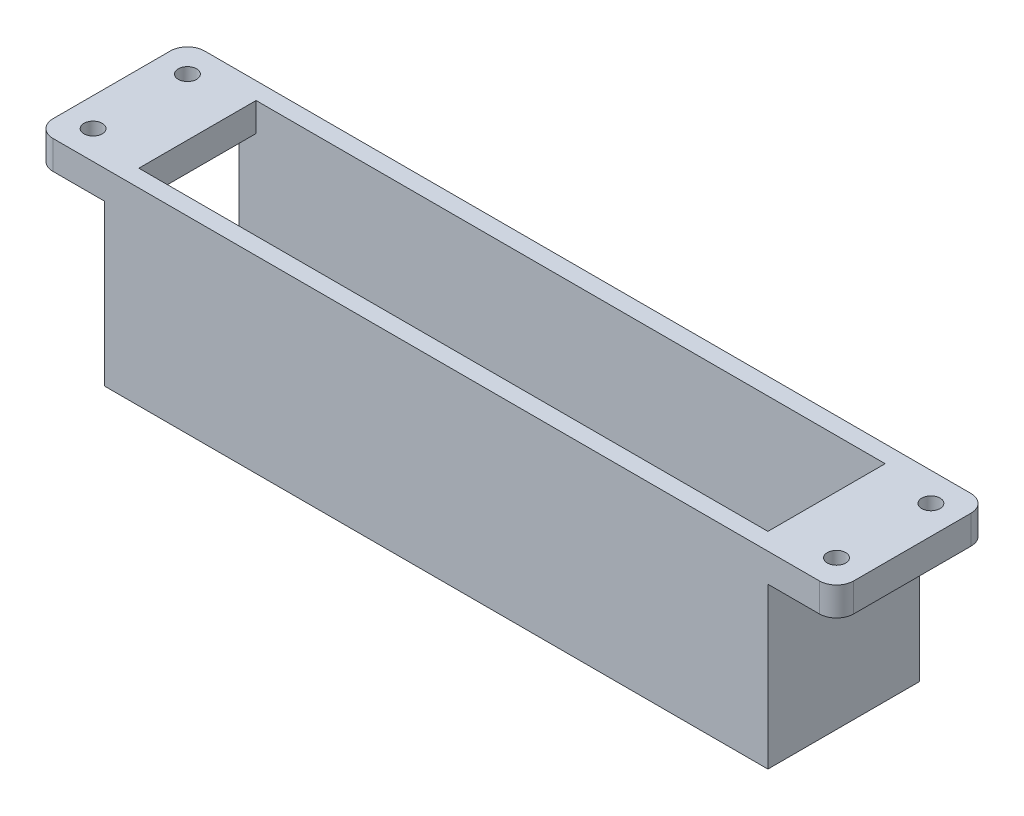
from build123d import *

# Parameters (mm, degrees)
DODANIE_WYCI_GNI_CIE1_DEPTH = 26.5
SZKIC2_W                    = 110
SZKIC2_H                    = 20.5
WYTNIJ_WYCI_GNI_CIE1_DEPTH  = 30
SZKIC4_W                    = 20.5
SZKIC4_H                    = 25
WYTNIJ_WYCI_GNI_CIE3_DEPTH  = 3
SZKIC5_R                    = 1.6
WYTNIJ_WYCI_GNI_CIE4_DEPTH  = 135.815614823
FILLET1_R                   = 3


with BuildPart() as part:
    # Szkic1 → Dodanie-wyciągnięcie1 (new body)
    with BuildSketch(Plane.XY):
        Polygon((0, 0), (116, 0), (116, 28), (128, 28), (128, 33), (-12, 33), (-12, 28), (0, 28), align=None)
    extrude(amount=DODANIE_WYCI_GNI_CIE1_DEPTH)

    # Szkic2 → Wytnij-wyciągnięcie1 (cut)
    with BuildSketch(Plane(origin=(0, 33, 0), x_dir=(1, 0, 0), z_dir=(0, 1, 0))):
        with Locations((58, -13.25)):
            Rectangle(SZKIC2_W, SZKIC2_H)
    extrude(amount=-WYTNIJ_WYCI_GNI_CIE1_DEPTH, mode=Mode.SUBTRACT)

    # Szkic4 → Wytnij-wyciągnięcie3 (cut)
    with BuildSketch(Plane.ZY):
        with Locations((13.25, 15.5)):
            Rectangle(SZKIC4_W, SZKIC4_H)
    extrude(amount=-WYTNIJ_WYCI_GNI_CIE3_DEPTH, mode=Mode.SUBTRACT)

    # Szkic5 → Wytnij-wyciągnięcie4 (cut, through all)
    with BuildSketch(Plane(origin=(0, 33, 0), x_dir=(1, 0, 0), z_dir=(0, 1, 0))):
        with Locations(Location((-7, -5, 0), (0, 0, 180))):
            Circle(SZKIC5_R)
        with Locations(Location((123, -5, 0), (0, 0, 180))):
            Circle(SZKIC5_R)
        with Locations(Location((123, -21.5, 0), (0, 0, 180))):
            Circle(SZKIC5_R)
        with Locations(Location((-7, -21.5, 0), (0, 0, 180))):
            Circle(SZKIC5_R)
    extrude(amount=-WYTNIJ_WYCI_GNI_CIE4_DEPTH, mode=Mode.SUBTRACT)

    # Fillet1
    fillet1_edges = [part.edges().sort_by_distance(p)[0] for p in [
        (128, 30.5, 26.5),
        (-12, 30.5, 26.5),
        (-12, 30.5, 0),
        (128, 30.5, 0),
    ]]
    fillet(fillet1_edges, radius=FILLET1_R)


solid = part.part
